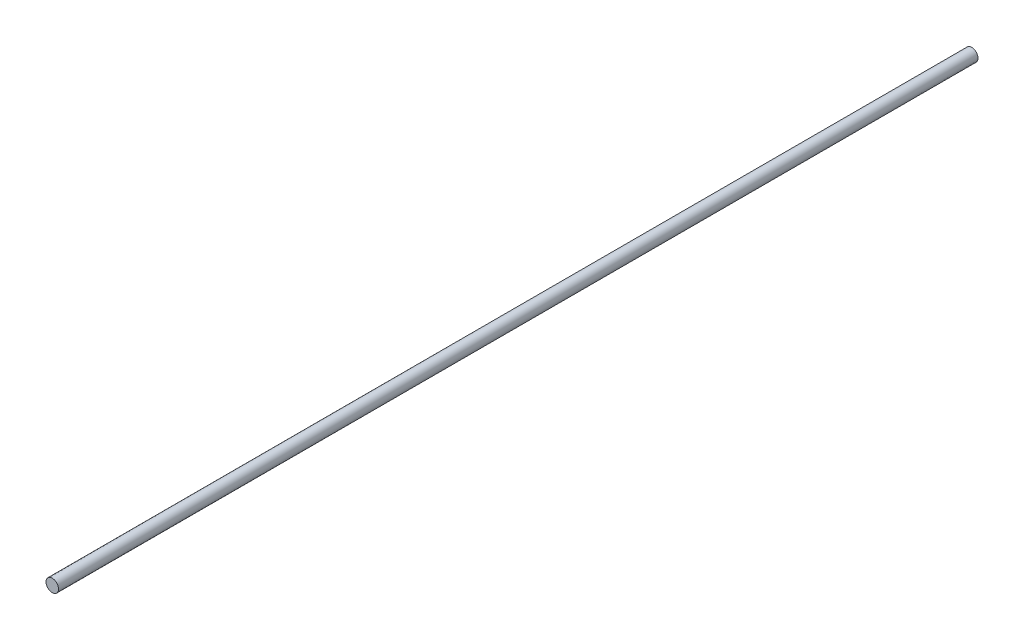
from build123d import *

# Parameters (mm, degrees)
SKETCH2_R           = 6
BOSS_EXTRUDE1_DEPTH = 440


with BuildPart() as part:
    # Sketch2 → Boss-Extrude1 (new, symmetric)
    with BuildSketch(Plane.XY):
        Circle(SKETCH2_R)
    extrude(amount=BOSS_EXTRUDE1_DEPTH, both=True)


solid = part.part
